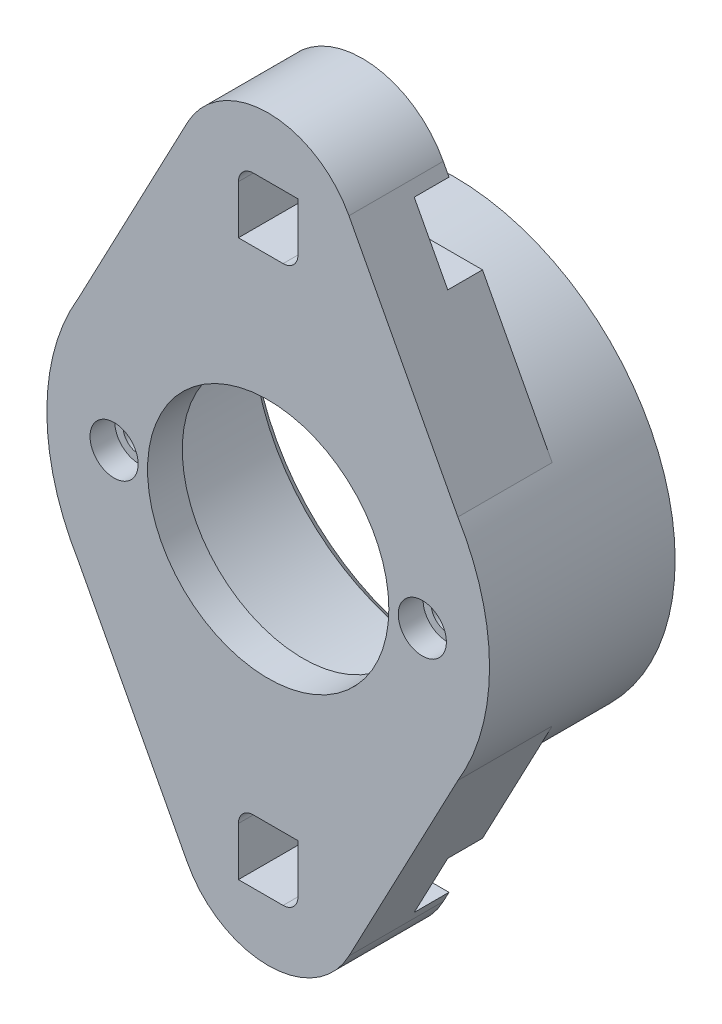
from build123d import *

# Parameters (mm, degrees)
SKETCH1_R           = 22.3
SKETCH1_R_2         = 1.6
SKETCH1_R_3         = 12.155
BOSS_EXTRUDE1_DEPTH = 1
BOSS_EXTRUDE2_START = -15.2
SKETCH1_3_R         = 22.3
SKETCH1_3_R_2       = 19.3
BOSS_EXTRUDE2_DEPTH = 15.2
SKETCH3_R           = 22.3
SKETCH3_R_2         = 2.425
SKETCH3_R_3         = 12.155
BOSS_EXTRUDE3_DEPTH = 2.5
BOSS_EXTRUDE4_START = -6
SKETCH4_W           = 6
SKETCH4_H           = 6.4
BOSS_EXTRUDE4_DEPTH = 6
CHAMFER1_SIZE       = 1
BOSS_EXTRUDE5_START = 3.5
BOSS_EXTRUDE5_DEPTH = 3.5
FILLET1_R           = 1.5


with BuildPart() as part:
    # Sketch1 → Boss-Extrude1 (new body)
    with BuildSketch(Plane.XY):
        Circle(SKETCH1_R)
        with Locations((15.5275, 0)):
            Circle(SKETCH1_R_2, mode=Mode.SUBTRACT)
        with Locations((-15.5275, 0)):
            Circle(SKETCH1_R_2, mode=Mode.SUBTRACT)
        Circle(SKETCH1_R_3, mode=Mode.SUBTRACT)
    extrude(amount=BOSS_EXTRUDE1_DEPTH)

    # Sketch1<3> → Boss-Extrude2 (add)
    with BuildSketch(Plane.XY.offset(BOSS_EXTRUDE2_START)):
        Circle(SKETCH1_3_R)
        Circle(SKETCH1_3_R_2, mode=Mode.SUBTRACT)
    extrude(amount=BOSS_EXTRUDE2_DEPTH)

    # Sketch3 → Boss-Extrude3 (add)
    with BuildSketch(Plane.XY.offset(1)):
        Circle(SKETCH3_R)
        with Locations((-15.5275, 0)):
            Circle(SKETCH3_R_2, mode=Mode.SUBTRACT)
        with Locations((15.5275, 0)):
            Circle(SKETCH3_R_2, mode=Mode.SUBTRACT)
        Circle(SKETCH3_R_3, mode=Mode.SUBTRACT)
    extrude(amount=BOSS_EXTRUDE3_DEPTH)

    # Sketch4 → Boss-Extrude4 (add)
    # profile 1 of 2: a face of its own
    with BuildSketch(Plane.XY.offset(3.5).offset(BOSS_EXTRUDE4_START)):
        with BuildLine():
            ThreePointArc((19.110610408, -11.49237007), (0, -22.3), (-19.110610408, -11.49237007))
            Line((-19.110610408, -11.49237007), (-8.137060123, -32.292814061))
            ThreePointArc((-8.137060123, -32.292814061), (0, -37.2), (8.137060123, -32.292814061))
            Line((8.137060123, -32.292814061), (19.110610408, -11.49237007))
        make_face()
        with Locations((0, -28)):
            Rectangle(SKETCH4_W, SKETCH4_H, mode=Mode.SUBTRACT)
    # profile 2 of 2: a face of its own
    with BuildSketch(Plane.XY.offset(3.5).offset(BOSS_EXTRUDE4_START)):
        with BuildLine():
            Line((-8.137060123, 32.292814061), (-19.110610408, 11.49237007))
            ThreePointArc((-19.110610408, 11.49237007), (0, 22.3), (19.110610408, 11.49237007))
            Line((19.110610408, 11.49237007), (8.137060123, 32.292814061))
            ThreePointArc((8.137060123, 32.292814061), (0, 37.2), (-8.137060123, 32.292814061))
        make_face()
        with Locations((0, 28)):
            Rectangle(SKETCH4_W, SKETCH4_H, mode=Mode.SUBTRACT)
    extrude(amount=BOSS_EXTRUDE4_DEPTH)

    # Chamfer1
    chamfer1_edges = [part.edges().sort_by_distance(p)[0] for p in [
        (-19.3, 0, -15.2),
    ]]
    chamfer(chamfer1_edges, length=CHAMFER1_SIZE)

    # Sketch5 → Boss-Extrude5 (add)
    with BuildSketch(Plane(origin=(0, 0, -2.5), x_dir=(-1, 0, 0), z_dir=(0, 0, -1)).offset(BOSS_EXTRUDE5_START)):
        with BuildLine():
            Line((8.713588684, -31.2), (-8.713588684, -31.2))
            Line((-8.713588684, -31.2), (-8.137060123, -32.292814061))
            ThreePointArc((-8.137060123, -32.292814061), (0, -37.2), (8.137060123, -32.292814061))
            Line((8.137060123, -32.292814061), (8.713588684, -31.2))
        make_face()
        with BuildLine():
            Line((-19.110610408, -11.49237007), (-12.089993623, -24.8))
            Line((-12.089993623, -24.8), (12.089993623, -24.8))
            Line((12.089993623, -24.8), (19.110610408, -11.49237007))
            ThreePointArc((19.110610408, -11.49237007), (0, -22.3), (-19.110610408, -11.49237007))
        make_face()
        with BuildLine():
            ThreePointArc((8.137060123, 32.292814061), (0, 37.2), (-8.137060123, 32.292814061))
            Line((-8.137060123, 32.292814061), (-8.713588684, 31.2))
            Line((-8.713588684, 31.2), (8.713588684, 31.2))
            Line((8.713588684, 31.2), (8.137060123, 32.292814061))
        make_face()
        with BuildLine():
            Line((12.089993623, 24.8), (-12.089993623, 24.8))
            Line((-12.089993623, 24.8), (-19.110610408, 11.49237007))
            ThreePointArc((-19.110610408, 11.49237007), (0, 22.3), (19.110610408, 11.49237007))
            Line((19.110610408, 11.49237007), (12.089993623, 24.8))
        make_face()
    extrude(amount=-BOSS_EXTRUDE5_DEPTH)

    # Fillet1
    fillet1_edges = [part.edges().sort_by_distance(p)[0] for p in [
        (3, -31.2, 0.5),
        (-3, -24.8, 0.5),
        (3, 24.8, 0.5),
        (-3, 31.2, 0.5),
    ]]
    fillet(fillet1_edges, radius=FILLET1_R)


solid = part.part
